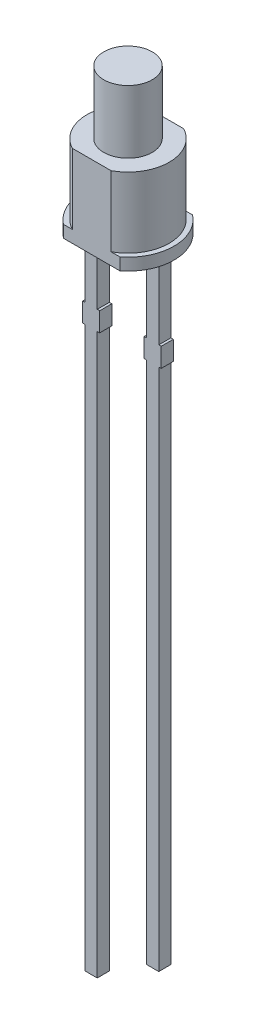
from build123d import *

# Parameters (mm, degrees)
SKETCH_1_R          = 1.9
EXTRUDE_1_DEPTH     = 0.5
SKETCH_2_R          = 1.7
EXTRUDE_2_DEPTH     = 2.9
SKETCH_3_R          = 1
EXTRUDE_3_DEPTH     = 2.6
SKETCH_4_W          = 0.5
SKETCH_4_H          = 25.5
SKETCH_4_H_2        = 27
SKETCH_4_W_2        = 0.7
SKETCH_4_H_3        = 0.791326506
EXTRUDE_4_DEPTH     = 0.25
CUT_EXTRUDE_2_REACH = 29.133
SKETCH_5_W          = 6.962557402
SKETCH_5_H          = 5.683720328
SKETCH_5_W_2        = 5.258758642
SKETCH_5_H_2        = 3


with BuildPart() as part:
    # Эскиз1 → Бобышка-Вытянуть1 (new body)
    with BuildSketch(Plane(origin=(0, 0, 0), x_dir=(1, 0, 0), z_dir=(0, 1, 0))):
        with Locations(Location((0, 0, 0), (0, 0, 270))):
            Circle(SKETCH_1_R)
    extrude(amount=EXTRUDE_1_DEPTH)

    # Эскиз2 → Бобышка-Вытянуть2 (add)
    with BuildSketch(Plane(origin=(0, 0.5, 0), x_dir=(1, 0, 0), z_dir=(0, 1, 0))):
        with Locations(Location((0, 0, 0), (0, 0, 270))):
            Circle(SKETCH_2_R)
    extrude(amount=EXTRUDE_2_DEPTH)

    # Эскиз3 → Бобышка-Вытянуть3 (add)
    with BuildSketch(Plane(origin=(0, 3.4, 0), x_dir=(1, 0, 0), z_dir=(0, 1, 0))):
        with Locations(Location((0, 0, 0), (0, 0, 270))):
            Circle(SKETCH_3_R)
    extrude(amount=EXTRUDE_3_DEPTH)

    # Эскиз4 → Бобышка-Вытянуть4 (add, symmetric)
    with BuildSketch(Plane.XY):
        with Locations((1.27, -12.75)):
            Rectangle(SKETCH_4_W, SKETCH_4_H)
        with Locations((-1.27, -13.5)):
            Rectangle(SKETCH_4_W, SKETCH_4_H_2)
        with Locations((1.27, -3.489413043)):
            Rectangle(SKETCH_4_W_2, SKETCH_4_H_3)
        with Locations((-1.27, -3.489413043)):
            Rectangle(SKETCH_4_W_2, SKETCH_4_H_3)
    extrude(amount=EXTRUDE_4_DEPTH, both=True)

    # Вырез-Вытянуть2: up to this face of the body (flat: up to its plane)
    cut_extrude_2_end = Plane(part.part.faces().sort_by_distance((0, 6, 0))[0])
    # Эскиз5 → Вырез-Вытянуть2 (cut, up to the picked face)
    with BuildSketch(Plane.XZ, mode=Mode.PRIVATE) as cut_extrude_2_sk1:
        Rectangle(SKETCH_5_W, SKETCH_5_H)
        Rectangle(SKETCH_5_W_2, SKETCH_5_H_2, mode=Mode.SUBTRACT)
    cut_extrude_2_tool1 = split(extrude(cut_extrude_2_sk1.sketch, amount=-CUT_EXTRUDE_2_REACH, mode=Mode.PRIVATE), bisect_by=cut_extrude_2_end, keep=Keep.BOTH, mode=Mode.PRIVATE)
    add(cut_extrude_2_tool1.solids().sort_by(Axis((0, 0, -2.751981), (0, 1, 0)))[0], mode=Mode.SUBTRACT)


solid = part.part
